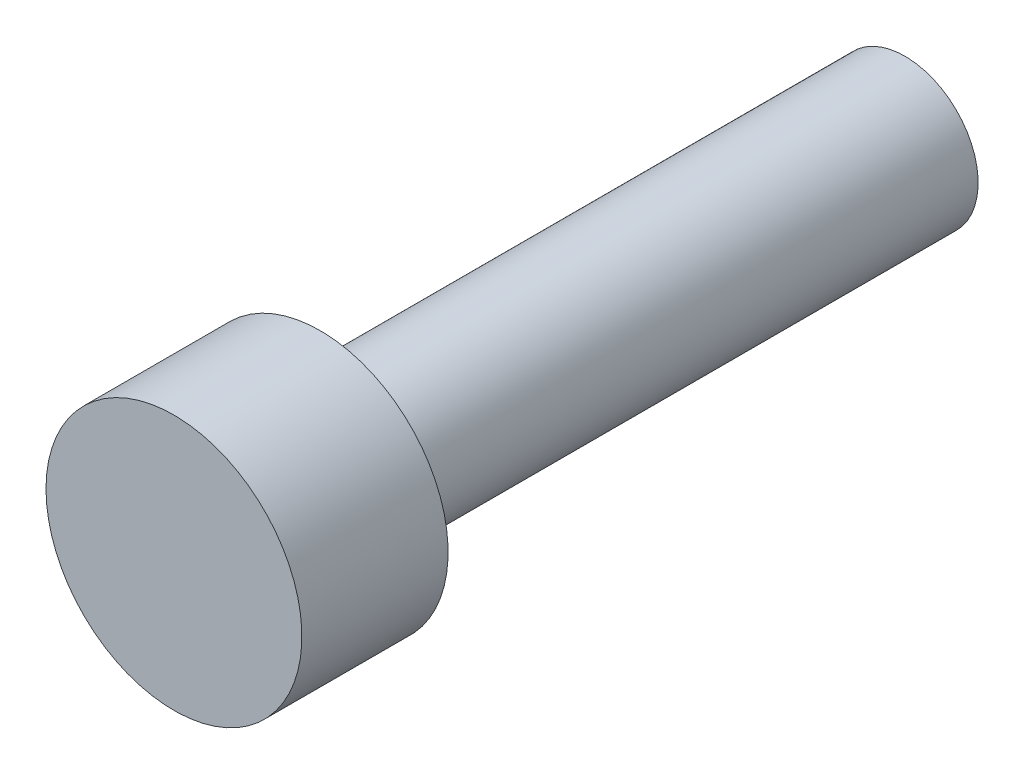
from build123d import *


with BuildPart() as part:
    # Sketch1 → REV_ISO4762_M4x16_8.8 (revolve)
    with BuildSketch(Plane(origin=(0, 0, 0), x_dir=(1, 0, 0), z_dir=(0, 1, 0)), mode=Mode.PRIVATE) as rev_iso4762_m4x16_8_8_sk:
        Polygon((0, -4), (3.5, -4), (3.5, 0), (2, 0), (2, 16), (0, 16), align=None)
    revolve(rev_iso4762_m4x16_8_8_sk.sketch.rotate(Axis((0, 0, -16), (0, 0, 1)), 180), axis=Axis((0, 0, -16), (0, 0, 1)))


solid = part.part
